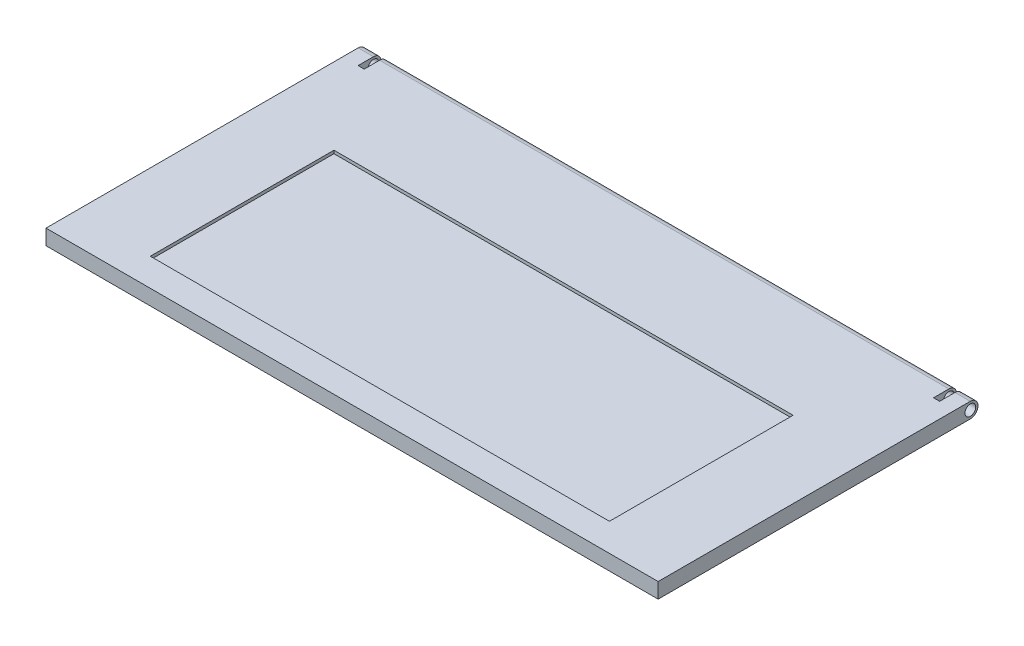
from build123d import *

# Parameters (mm, degrees)
SKETCH1_W           = 186
SKETCH1_H           = 95
BOSS_EXTRUDE1_DEPTH = 5
SKETCH2_W           = 150
SKETCH2_H           = 60
CUT_EXTRUDE1_DEPTH  = 1
SKETCH4_R           = 1.75
BOSS_EXTRUDE2_DEPTH = 186
SKETCH6_W           = 96.969797672
SKETCH6_H           = 5
BOSS_EXTRUDE3_DEPTH = 2
BOSS_EXTRUDE4_START = 5
SKETCH7_R           = 1.75
BOSS_EXTRUDE4_DEPTH = 5


with BuildPart() as part:
    # Sketch1 → Boss-Extrude1 (new body)
    with BuildSketch(Plane(origin=(0, 0, 0), x_dir=(1, 0, 0), z_dir=(0, 1, 0))):
        Rectangle(SKETCH1_W, SKETCH1_H)
    extrude(amount=BOSS_EXTRUDE1_DEPTH)

    # Sketch2 → Cut-Extrude1 (cut)
    with BuildSketch(Plane(origin=(0, 5, 0), x_dir=(1, 0, 0), z_dir=(0, 1, 0))):
        with Locations((0, -8.418340883)):
            Rectangle(SKETCH2_W, SKETCH2_H)
    extrude(amount=-CUT_EXTRUDE1_DEPTH, mode=Mode.SUBTRACT)

    # Sketch4 → Boss-Extrude2 (add, through all)
    with BuildSketch(Plane.ZY.offset(93)):
        with BuildLine():
            Line((-47.5, 0), (-47.5, 5))
            Line((-47.5, 5), (-54.5, 5))
            ThreePointArc((-54.5, 5), (-57, 2.5), (-54.5, 0))
            Line((-54.5, 0), (-47.5, 0))
        make_face()
        with Locations((-54.5, 2.5)):
            Circle(SKETCH4_R, mode=Mode.SUBTRACT)
    extrude(amount=-BOSS_EXTRUDE2_DEPTH)

    # Sketch6 → Boss-Extrude3 (add)
    with BuildSketch(Plane.ZY.offset(93)):
        with Locations((-0.984898836, 2.5)):
            Rectangle(SKETCH6_W, SKETCH6_H)
    boss_extrude3 = extrude(amount=BOSS_EXTRUDE3_DEPTH)

    # Mirror2: Boss-Extrude3 across plane
    add(boss_extrude3.mirror(Plane.ZY))

    # Sketch7 → Boss-Extrude4 (add)
    with BuildSketch(Plane.ZY.offset(95).offset(BOSS_EXTRUDE4_START)):
        with BuildLine():
            Line((-54.5, 5), (47.5, 5))
            Line((47.5, 5), (47.5, 0))
            Line((47.5, 0), (-54.5, 0))
            ThreePointArc((-54.5, 0), (-57, 2.5), (-54.5, 5))
        make_face()
        with Locations((-54.5, 2.5)):
            Circle(SKETCH7_R, mode=Mode.SUBTRACT)
    boss_extrude4 = extrude(amount=-BOSS_EXTRUDE4_DEPTH)

    # Mirror3: Boss-Extrude4 across plane
    add(boss_extrude4.mirror(Plane.ZY))


solid = part.part
